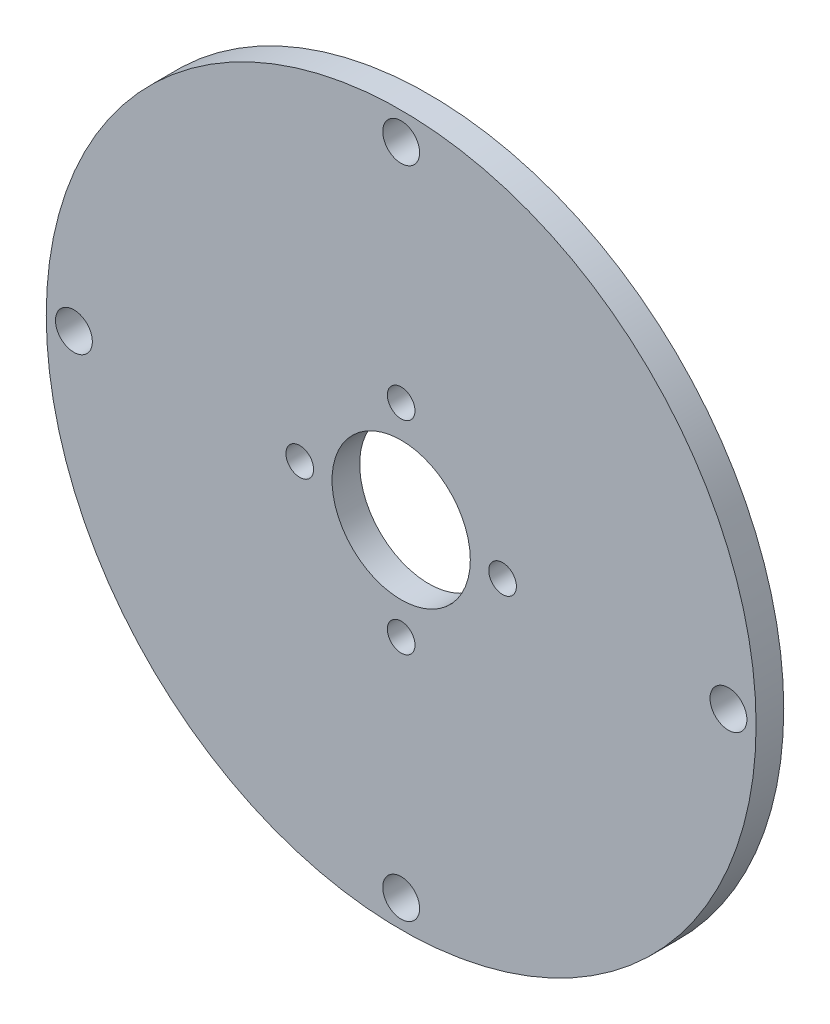
from build123d import *

# Parameters (mm, degrees)
SKETCH1_R           = 38.5
SKETCH1_R_2         = 1.5
SKETCH1_R_3         = 2
SKETCH1_R_4         = 7.5
BOSS_EXTRUDE1_DEPTH = 3


with BuildPart() as part:
    # Sketch1 → Boss-Extrude1 (new body)
    with BuildSketch(Plane.XY):
        Circle(SKETCH1_R)
        with Locations((0, 11)):
            Circle(SKETCH1_R_2, mode=Mode.SUBTRACT)
        with Locations((0, 35.5)):
            Circle(SKETCH1_R_3, mode=Mode.SUBTRACT)
        with Locations((35.5, 0)):
            Circle(SKETCH1_R_3, mode=Mode.SUBTRACT)
        with Locations((11, 0)):
            Circle(SKETCH1_R_2, mode=Mode.SUBTRACT)
        with Locations((0, -35.5)):
            Circle(SKETCH1_R_3, mode=Mode.SUBTRACT)
        with Locations((0, -11)):
            Circle(SKETCH1_R_2, mode=Mode.SUBTRACT)
        with Locations((-35.5, 0)):
            Circle(SKETCH1_R_3, mode=Mode.SUBTRACT)
        with Locations((-11, 0)):
            Circle(SKETCH1_R_2, mode=Mode.SUBTRACT)
        Circle(SKETCH1_R_4, mode=Mode.SUBTRACT)
    extrude(amount=BOSS_EXTRUDE1_DEPTH)


solid = part.part
